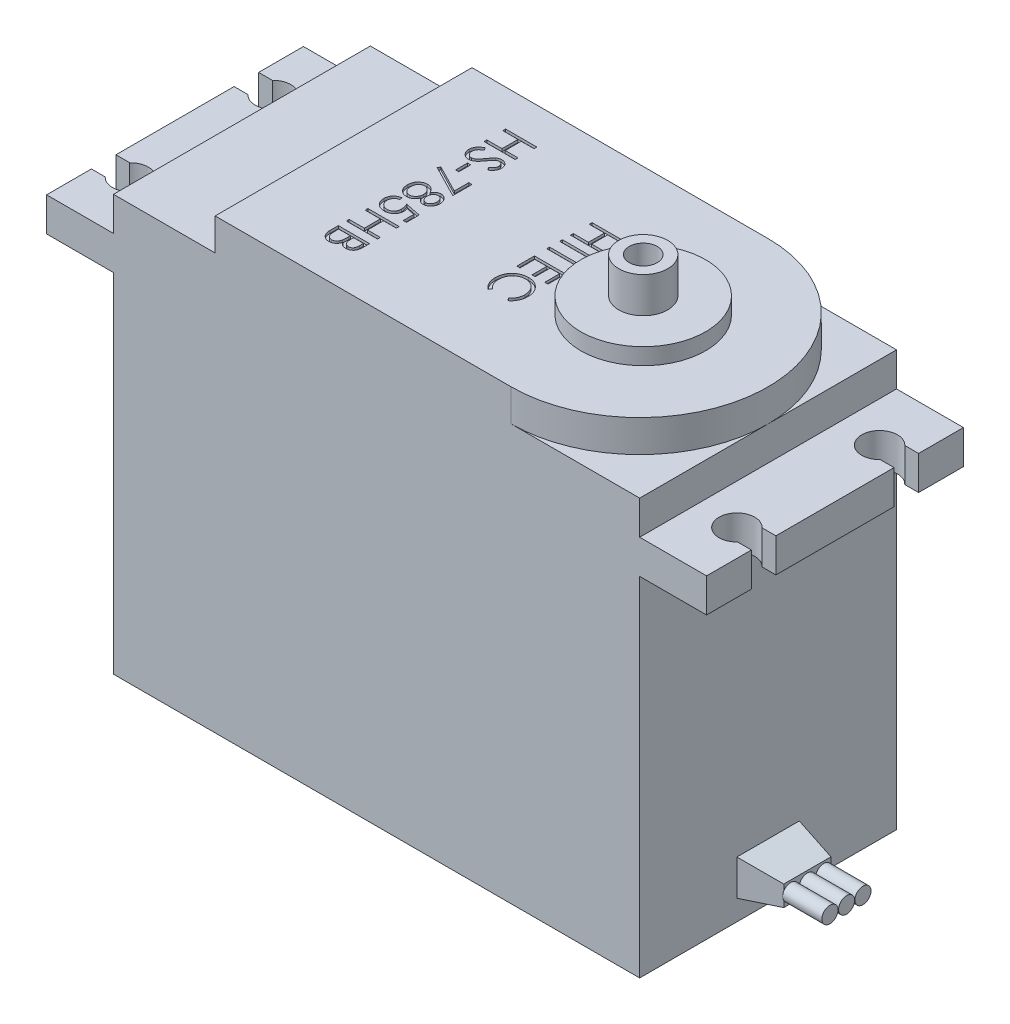
from build123d import *

# Parameters (mm, degrees)
SKETCH1_W                        = 59
SKETCH1_H                        = 46.6
BOSS_EXTRUDE1_DEPTH              = 28.8
BOSS_EXTRUDE2_DEPTH              = 3.6
SKETCH3_R                        = 7
BOSS_EXTRUDE3_DEPTH              = 1.85
BOSS_EXTRUDE4_DEPTH              = 3.8
SKETCH5_W                        = 7
SKETCH5_H                        = 4
BOSS_EXTRUDE5_DEPTH              = 4.4
BOSS_EXTRUDE5_TAPER              = 11
SKETCH6_R                        = 0.902956787
BOSS_EXTRUDE6_DEPTH              = 4.4
SKETCH7_R                        = 2.75
BOSS_EXTRUDE7_DEPTH              = 4
TAP_DRILL_FOR_M3_HELICOIL1_D     = 3.15
TAP_DRILL_FOR_M3_HELICOIL1_DEPTH = 3
TAP_DRILL_FOR_M3_HELICOIL1_TIP   = 0.946355475
SKETCH10_W                       = 3.5
SKETCH10_H                       = 0.314102564
SKETCH10_W_2                     = 0.358974359
SKETCH10_H_2                     = 1.346153846
CUT_EXTRUDE1_DEPTH               = 0.3


with BuildPart() as part:
    # Sketch1 → Boss-Extrude1 (new body)
    with BuildSketch(Plane.XY):
        with Locations((29.5, 23.3)):
            Rectangle(SKETCH1_W, SKETCH1_H)
    extrude(amount=BOSS_EXTRUDE1_DEPTH)

    # Sketch2 → Boss-Extrude2 (add)
    with BuildSketch(Plane(origin=(0, 46.6, 0), x_dir=(1, 0, 0), z_dir=(0, 1, 0))):
        with BuildLine():
            Line((11.4, 0), (44.6, 0))
            ThreePointArc((44.6, 0), (59, -14.4), (44.6, -28.8))
            Line((44.6, -28.8), (11.4, -28.8))
            Line((11.4, -28.8), (11.4, 0))
        make_face()
    extrude(amount=BOSS_EXTRUDE2_DEPTH)

    # Sketch3 → Boss-Extrude3 (add)
    with BuildSketch(Plane(origin=(0, 50.2, 0), x_dir=(1, 0, 0), z_dir=(0, 1, 0))):
        with Locations(Location((45, -14.4, 0), (0, 0, 270))):
            Circle(SKETCH3_R)
    extrude(amount=BOSS_EXTRUDE3_DEPTH)

    # Sketch4 → Boss-Extrude4 (add)
    with BuildSketch(Plane(origin=(0, 39, 0), x_dir=(-1, 0, 0), z_dir=(0, -1, 0))):
        with BuildLine():
            Line((-66.5, 0), (7.5, 0))
            Line((7.5, 0), (7.5, -5.025))
            Line((7.5, -5.025), (5.952368755, -5.025))
            ThreePointArc((5.952368755, -5.025), (2.5, -6.4), (5.952368755, -7.775))
            Line((5.952368755, -7.775), (7.5, -7.775))
            Line((7.5, -7.775), (7.5, -21.025))
            Line((7.5, -21.025), (5.952368755, -21.025))
            ThreePointArc((5.952368755, -21.025), (2.5, -22.4), (5.952368755, -23.775))
            Line((5.952368755, -23.775), (7.5, -23.775))
            Line((7.5, -23.775), (7.5, -28.8))
            Line((7.5, -28.8), (-66.5, -28.8))
            Line((-66.5, -28.8), (-66.5, -23.775))
            Line((-66.5, -23.775), (-64.952368755, -23.775))
            ThreePointArc((-64.952368755, -23.775), (-61.5, -22.4), (-64.952368755, -21.025))
            Line((-64.952368755, -21.025), (-66.5, -21.025))
            Line((-66.5, -21.025), (-66.5, -7.775))
            Line((-66.5, -7.775), (-64.952368755, -7.775))
            ThreePointArc((-64.952368755, -7.775), (-61.5, -6.4), (-64.952368755, -5.025))
            Line((-64.952368755, -5.025), (-66.5, -5.025))
            Line((-66.5, -5.025), (-66.5, 0))
        make_face()
    extrude(amount=-BOSS_EXTRUDE4_DEPTH)

    # Sketch5 → Boss-Extrude5 (add)
    with BuildSketch(Plane(origin=(59, 0, 0), x_dir=(0, 0, -1), z_dir=(1, 0, 0))):
        with Locations((-14.4, 4.3)):
            Rectangle(SKETCH5_W, SKETCH5_H)
    extrude(amount=BOSS_EXTRUDE5_DEPTH, taper=BOSS_EXTRUDE5_TAPER)

    # Sketch6 → Boss-Extrude6 (add)
    with BuildSketch(Plane(origin=(63.4, 0, 0), x_dir=(0, 0, -1), z_dir=(1, 0, 0))):
        with Locations((-14.4, 4.3)):
            Circle(SKETCH6_R)
        with Locations(Location((-12.562723312, 4.3, 0), (0, 0, 333.409541009))):
            Circle(SKETCH6_R)
        with Locations(Location((-16.265911653, 4.3, 0), (0, 0, 210.399697168))):
            Circle(SKETCH6_R)
    extrude(amount=BOSS_EXTRUDE6_DEPTH)

    # Sketch7 → Boss-Extrude7 (add)
    with BuildSketch(Plane(origin=(0, 52.05, 0), x_dir=(1, 0, 0), z_dir=(0, 1, 0))):
        with Locations(Location((45, -14.4, 0), (0, 0, 270))):
            Circle(SKETCH7_R)
    extrude(amount=BOSS_EXTRUDE7_DEPTH)

    # Tap Drill for M3 Helicoil1
    with Locations(Plane(origin=(0, 56.05, 0), x_dir=(1, 0, 0), z_dir=(0, 1, 0))):
        with Locations((45, -14.4)):
            Hole(TAP_DRILL_FOR_M3_HELICOIL1_D / 2, depth=TAP_DRILL_FOR_M3_HELICOIL1_DEPTH)
            with Locations((0, 0, -(TAP_DRILL_FOR_M3_HELICOIL1_DEPTH + TAP_DRILL_FOR_M3_HELICOIL1_TIP / 2))):  # 118° drill point
                Cone(0, TAP_DRILL_FOR_M3_HELICOIL1_D / 2, TAP_DRILL_FOR_M3_HELICOIL1_TIP, mode=Mode.SUBTRACT)

    # Sketch10 → Cut-Extrude1 (cut)
    # profile 1 of 13: a face of its own
    with BuildSketch(Plane(origin=(0, 50.2, 0), x_dir=(1, 0, 0), z_dir=(0, 1, 0))):
        Polygon((36.683305058, -8.319871795), (36.683305058, -8.633974359), (35.247407622, -8.633974359), (35.247407622, -10.428846154), (36.683305058, -10.428846154), (36.683305058, -10.742948718), (33.183305058, -10.742948718), (33.183305058, -10.428846154), (34.888433263, -10.428846154), (34.888433263, -8.633974359), (33.183305058, -8.633974359), (33.183305058, -8.319871795), align=None)
    # profile 2 of 13: a face of its own
    with BuildSketch(Plane(origin=(0, 50.2, 0), x_dir=(1, 0, 0), z_dir=(0, 1, 0))):
        with Locations((34.933305058, -11.797435897)):
            Rectangle(SKETCH10_W, SKETCH10_H)
    # profile 3 of 13: a face of its own
    with BuildSketch(Plane(origin=(0, 50.2, 0), x_dir=(1, 0, 0), z_dir=(0, 1, 0))):
        Polygon((36.324330699, -12.313461538), (36.683305058, -12.313461538), (36.683305058, -14.153205128), (36.324330699, -14.153205128), (36.324330699, -13.390384615), (33.183305058, -13.390384615), (33.183305058, -13.076282051), (36.324330699, -13.076282051), align=None)
    # profile 4 of 13: a face of its own
    with BuildSketch(Plane(origin=(0, 50.2, 0), x_dir=(1, 0, 0), z_dir=(0, 1, 0))):
        Polygon((36.683305058, -14.781410256), (36.683305058, -16.755769231), (36.324330699, -16.755769231), (36.324330699, -15.095512821), (35.247407622, -15.095512821), (35.247407622, -16.755769231), (34.888433263, -16.755769231), (34.888433263, -15.095512821), (33.542279417, -15.095512821), (33.542279417, -16.755769231), (33.183305058, -16.755769231), (33.183305058, -14.781410256), align=None)
    # profile 5 of 13: a face of its own
    with BuildSketch(Plane(origin=(0, 50.2, 0), x_dir=(1, 0, 0), z_dir=(0, 1, 0))):
        with BuildLine():
            Line((36.041077494, -20.61474359), (35.830740956, -20.339903846))
            add(Edge.make_bspline(
                [(35.830740956, -20.339903846), (35.854106926, -20.320297958), (35.900523841, -20.281350511), (35.965703386, -20.218691308), (36.026768647, -20.153389666), (36.084010527, -20.085470544), (36.135427293, -20.013711425), (36.183698395, -19.939850626), (36.226966133, -19.862652581), (36.27942912, -19.755900846), (36.334175275, -19.616252998), (36.380078506, -19.440458159), (36.409299682, -19.25694706), (36.412464523, -19.131749461), (36.414074289, -19.06806891)],
                knots=[0, 0, 0, 0, 0.757959112, 1.505699292, 2.245454638, 2.979532153, 3.711538275, 4.438200793, 5.171680507, 5.909471876, 7.393775596, 8.890124382, 10.418191784, 12, 12, 12, 12], degree=3))
            add(Edge.make_bspline(
                [(36.414074289, -19.06806891), (36.413668504, -19.032986037), (36.412860699, -18.963145894), (36.402278474, -18.859491127), (36.387233738, -18.757575594), (36.365453359, -18.657778283), (36.33709728, -18.560297345), (36.30384317, -18.464390545), (36.262461804, -18.371187409), (36.21676161, -18.27956626), (36.165128789, -18.191791102), (36.108828525, -18.108723125), (36.048413397, -18.030741827), (35.984039353, -17.95763112), (35.914906353, -17.890192822), (35.841827667, -17.827346132), (35.7639237, -17.770223697), (35.682655477, -17.717421831), (35.597903548, -17.670437615), (35.510201074, -17.629864469), (35.419883374, -17.59508991), (35.326765425, -17.567318559), (35.23121367, -17.54541356), (35.133025326, -17.530280591), (35.032390981, -17.519793562), (34.964181759, -17.518993189), (34.929799449, -17.518589744)],
                knots=[0, 0, 0, 0, 1.055000685, 2.100209969, 3.131349012, 4.153242145, 5.170189196, 6.184191144, 7.204341339, 8.235672124, 9.263040994, 10.265373269, 11.252624173, 12.22887325, 13.193405896, 14.155809299, 15.126090485, 16.097288279, 17.069732292, 18.038585918, 19.002221264, 19.978698174, 20.959418239, 21.948869816, 22.966084182, 24, 24, 24, 24], degree=3))
            add(Edge.make_bspline(
                [(34.929799449, -17.518589744), (34.878068129, -17.519851563), (34.776500545, -17.522328977), (34.627729934, -17.544377311), (34.48520926, -17.577882402), (34.349829418, -17.628097979), (34.21992106, -17.69001703), (34.097682206, -17.768257641), (33.981265642, -17.858874179), (33.873422694, -17.963148598), (33.774908969, -18.077554414), (33.688158387, -18.200302326), (33.615843505, -18.331086613), (33.555667558, -18.468463244), (33.509410831, -18.613489358), (33.476846707, -18.76590416), (33.455604527, -18.925376155), (33.453570839, -19.034345555), (33.452535828, -19.089803686)],
                knots=[0, 0, 0, 0, 1.029171465, 2.020641659, 2.987623507, 3.938342917, 4.889210282, 5.84687017, 6.821220943, 7.821438502, 8.827599549, 9.822697543, 10.807740252, 11.797342354, 12.80366471, 13.83203677, 14.896651826, 16, 16, 16, 16], degree=3))
            add(Edge.make_bspline(
                [(33.452535828, -19.089803686), (33.454224607, -19.150906375), (33.45754853, -19.271171084), (33.485707779, -19.44753911), (33.531365697, -19.616374876), (33.595263619, -19.777687462), (33.678328907, -19.931022109), (33.779026784, -20.076618769), (33.898315117, -20.214600339), (33.989398245, -20.297571622), (34.035869161, -20.339903846)],
                knots=[0, 0, 0, 0, 1.028121516, 2.023589091, 2.998037872, 3.967518031, 4.937445131, 5.927275754, 6.942489185, 8, 8, 8, 8], degree=3))
            Line((34.035869161, -20.339903846), (33.827635988, -20.61474359))
            add(Edge.make_bspline(
                [(33.827635988, -20.61474359), (33.799097487, -20.592625509), (33.742157183, -20.548495293), (33.661886197, -20.47703684), (33.586379459, -20.401761169), (33.516261894, -20.322099407), (33.450069724, -20.239004308), (33.390021991, -20.151012194), (33.334289542, -20.05964286), (33.283933108, -19.96436434), (33.238783038, -19.865489446), (33.200666101, -19.763121075), (33.167359007, -19.658126498), (33.140138788, -19.550452839), (33.11885907, -19.43974039), (33.104641766, -19.326369008), (33.094899211, -19.210099378), (33.094011383, -19.131657923), (33.093561469, -19.091907051)],
                knots=[0, 0, 0, 0, 0.986756325, 1.968786143, 2.935506311, 3.899499537, 4.868307269, 5.8376204, 6.809456583, 7.792545619, 8.781780509, 9.778496008, 10.776623214, 11.79151764, 12.812666265, 13.856269958, 14.913646641, 16, 16, 16, 16], degree=3))
            add(Edge.make_bspline(
                [(33.093561469, -19.091907051), (33.093823461, -19.054263384), (33.094341519, -18.979827694), (33.102733686, -18.869928943), (33.114183423, -18.762939362), (33.131423554, -18.659164736), (33.151767894, -18.558038761), (33.179039151, -18.460478176), (33.209588318, -18.365522966), (33.245493304, -18.273554625), (33.286009487, -18.184494925), (33.331801046, -18.098631114), (33.38248291, -18.016002682), (33.436937921, -17.935797261), (33.496915223, -17.859199677), (33.561581857, -17.785546152), (33.630719868, -17.714423676), (33.680574721, -17.670420991), (33.705640795, -17.648297276)],
                knots=[0, 0, 0, 0, 1.114604814, 2.203992996, 3.262667896, 4.300477797, 5.318619304, 6.316056647, 7.298880507, 8.271930387, 9.238335007, 10.195173496, 11.151986948, 12.108099108, 13.064862484, 14.031167946, 15.010108607, 16, 16, 16, 16], degree=3))
            add(Edge.make_bspline(
                [(33.705640795, -17.648297276), (33.749181984, -17.612861632), (33.835738695, -17.542418155), (33.976024676, -17.452292472), (34.122492885, -17.375144917), (34.275912814, -17.312768996), (34.435940201, -17.264006263), (34.602655715, -17.230225068), (34.775903658, -17.208273463), (34.893740446, -17.205763174), (34.95363759, -17.204487179)],
                knots=[0, 0, 0, 0, 0.994628077, 1.977248131, 2.950237994, 3.925870899, 4.908910175, 5.911660606, 6.938484602, 8, 8, 8, 8], degree=3))
            add(Edge.make_bspline(
                [(34.95363759, -17.204487179), (35.01659041, -17.206049329), (35.140446152, -17.209122761), (35.322257699, -17.235019276), (35.496195366, -17.277183806), (35.662928426, -17.335244644), (35.821502893, -17.411842414), (35.972588496, -17.504570209), (36.116061868, -17.614333755), (36.25008869, -17.739754528), (36.372624778, -17.877329111), (36.480431835, -18.02464603), (36.570149126, -18.181428476), (36.645145349, -18.345946194), (36.702789796, -18.519431912), (36.743142987, -18.701515271), (36.768260102, -18.891854188), (36.77143531, -19.021716614), (36.773048648, -19.087700321)],
                knots=[0, 0, 0, 0, 1.032901378, 2.032168977, 3.007206631, 3.966850309, 4.924221947, 5.891988639, 6.871730993, 7.884084801, 8.900290346, 9.89161143, 10.874607481, 11.860025555, 12.854717796, 13.869097222, 14.917278314, 16, 16, 16, 16], degree=3))
            add(Edge.make_bspline(
                [(36.773048648, -19.087700321), (36.77256687, -19.127914871), (36.771613239, -19.207515525), (36.762301875, -19.325267035), (36.746807469, -19.439913561), (36.725579086, -19.551732359), (36.699560204, -19.661128908), (36.665499477, -19.76698088), (36.625946623, -19.86986468), (36.581554218, -19.969857361), (36.530803527, -20.065871033), (36.475682957, -20.157888224), (36.414920141, -20.244798913), (36.350523899, -20.328237898), (36.280085389, -20.406326703), (36.205898495, -20.481295523), (36.125761834, -20.550554655), (36.06935728, -20.593308111), (36.041077494, -20.61474359)],
                knots=[0, 0, 0, 0, 1.096705196, 2.170817488, 3.219277236, 4.250701065, 5.274195539, 6.284202015, 7.28098643, 8.279664616, 9.266225751, 10.241373748, 11.203306326, 12.157093976, 13.114198862, 14.069774147, 15.032234603, 16, 16, 16, 16], degree=3))
        make_face()
    # profile 6 of 13: a face of its own
    with BuildSketch(Plane(origin=(0, 50.2, 0), x_dir=(1, 0, 0), z_dir=(0, 1, 0))):
        Polygon((22.747407622, -4.079487179), (22.747407622, -4.393589744), (21.311510186, -4.393589744), (21.311510186, -6.188461538), (22.747407622, -6.188461538), (22.747407622, -6.502564103), (19.247407622, -6.502564103), (19.247407622, -6.188461538), (20.952535828, -6.188461538), (20.952535828, -4.393589744), (19.247407622, -4.393589744), (19.247407622, -4.079487179), align=None)
    # profile 7 of 13: a face of its own
    with BuildSketch(Plane(origin=(0, 50.2, 0), x_dir=(1, 0, 0), z_dir=(0, 1, 0))):
        with BuildLine():
            Line((19.922587911, -7.041025641), (20.099971725, -7.336899038))
            add(Edge.make_bspline(
                [(20.099971725, -7.336899038), (20.05390734, -7.364417276), (19.965649756, -7.417141156), (19.846391716, -7.505092515), (19.745029559, -7.596225427), (19.662152951, -7.69121476), (19.596904065, -7.789480708), (19.550701833, -7.891664762), (19.521885858, -7.997422573), (19.518385771, -8.069396394), (19.516638392, -8.105328526)],
                knots=[0, 0, 0, 0, 1.272034388, 2.437168799, 3.508375237, 4.49857839, 5.41946034, 6.295179144, 7.148887113, 8, 8, 8, 8], degree=3))
            add(Edge.make_bspline(
                [(19.516638392, -8.105328526), (19.517493063, -8.136015389), (19.519187451, -8.196852169), (19.535468269, -8.286414365), (19.560480339, -8.373396343), (19.596301492, -8.456004325), (19.639639177, -8.533102307), (19.691988167, -8.600700683), (19.750584394, -8.659176318), (19.81600334, -8.706878063), (19.886116253, -8.743909237), (19.958727613, -8.770706019), (20.033518027, -8.78776056), (20.084223671, -8.78993126), (20.10978743, -8.791025641)],
                knots=[0, 0, 0, 0, 1.095270387, 2.171376115, 3.241375676, 4.322296363, 5.380636668, 6.392615365, 7.366724986, 8.328592944, 9.273498763, 10.190095884, 11.087518669, 12, 12, 12, 12], degree=3))
            add(Edge.make_bspline(
                [(20.10978743, -8.791025641), (20.13892828, -8.78955133), (20.198167369, -8.786554272), (20.285567022, -8.761222792), (20.372059592, -8.721373545), (20.425560857, -8.684610901), (20.45333711, -8.66552484)],
                knots=[0, 0, 0, 0, 0.938893495, 1.908633276, 2.914225137, 4, 4, 4, 4], degree=3))
            add(Edge.make_bspline(
                [(20.45333711, -8.66552484), (20.473424914, -8.649898589), (20.515720536, -8.616996933), (20.577626006, -8.559650246), (20.643041848, -8.494108524), (20.711702424, -8.420044108), (20.782353821, -8.33598475), (20.856468773, -8.243656508), (20.933824538, -8.142581436), (20.98497915, -8.071348293), (21.011430058, -8.034515224)],
                knots=[0, 0, 0, 0, 0.72226686, 1.520759855, 2.393439377, 3.351307446, 4.386958158, 5.510256019, 6.712608938, 8, 8, 8, 8], degree=3))
            add(Edge.make_bspline(
                [(21.011430058, -8.034515224), (21.037664649, -7.99769614), (21.08782319, -7.927300855), (21.162169862, -7.828778771), (21.230577014, -7.740796461), (21.292091762, -7.662905611), (21.349397065, -7.597121357), (21.39942168, -7.54103881), (21.444836864, -7.496727067), (21.474274834, -7.472068628), (21.487491757, -7.460997596)],
                knots=[0, 0, 0, 0, 1.452255772, 2.776602448, 3.96446981, 5.032613149, 5.964194703, 6.766668629, 7.446264616, 8, 8, 8, 8], degree=3))
            add(Edge.make_bspline(
                [(21.487491757, -7.460997596), (21.508092794, -7.445525051), (21.548607498, -7.415096214), (21.611932355, -7.374930209), (21.676755621, -7.340791046), (21.743251485, -7.314028714), (21.810486414, -7.291492495), (21.87933766, -7.276334564), (21.949496278, -7.266843167), (21.996709779, -7.265871181), (22.020344321, -7.265384615)],
                knots=[0, 0, 0, 0, 1.068054152, 2.10047183, 3.106115577, 4.101338837, 5.06977816, 6.043150881, 7.020423561, 8, 8, 8, 8], degree=3))
            add(Edge.make_bspline(
                [(22.020344321, -7.265384615), (22.057377196, -7.266684131), (22.130651394, -7.269255386), (22.237637242, -7.291178507), (22.340091869, -7.325377128), (22.435758513, -7.374838346), (22.524413456, -7.435990725), (22.604702196, -7.508263232), (22.672773126, -7.594070926), (22.731558291, -7.68874351), (22.777971638, -7.791701207), (22.813169233, -7.89939519), (22.832846845, -8.012297701), (22.835702325, -8.088897337), (22.837151212, -8.127764423)],
                knots=[0, 0, 0, 0, 1.005541892, 1.989591032, 2.955705311, 3.932863626, 4.905387107, 5.876519979, 6.856563935, 7.871847665, 8.897921447, 9.918317993, 10.943742853, 12, 12, 12, 12], degree=3))
            add(Edge.make_bspline(
                [(22.837151212, -8.127764423), (22.835755309, -8.169014671), (22.832987065, -8.250818846), (22.808056049, -8.371374893), (22.767784565, -8.487668665), (22.721401583, -8.581279452), (22.675283691, -8.654416578), (22.633260872, -8.710188344), (22.584886653, -8.766706082), (22.530027144, -8.824424052), (22.46818047, -8.882364737), (22.399769759, -8.941388182), (22.325213209, -9.001632453), (22.271988708, -9.040388312), (22.244703295, -9.06025641)],
                knots=[0, 0, 0, 0, 1.286821612, 2.551921131, 3.825787379, 5.12137259, 5.803616487, 6.523126609, 7.299589446, 8.125436757, 9.008162487, 9.944516264, 10.946261234, 12, 12, 12, 12], degree=3))
            Line((22.244703295, -9.06025641), (22.029458904, -8.776302083))
            add(Edge.make_bspline(
                [(22.029458904, -8.776302083), (22.051547595, -8.759156151), (22.09408525, -8.726137094), (22.153656557, -8.676007605), (22.208073065, -8.628758966), (22.255338101, -8.582208537), (22.298040533, -8.538815001), (22.334599308, -8.496697646), (22.365378092, -8.45646431), (22.398208343, -8.405743161), (22.430958948, -8.341857599), (22.458082041, -8.261741847), (22.474968056, -8.178246762), (22.477095496, -8.121534572), (22.478176853, -8.092708333)],
                knots=[0, 0, 0, 0, 1.181667846, 2.275615987, 3.290305621, 4.226321945, 5.078535498, 5.862783384, 6.581873284, 7.217493746, 8.414623899, 9.604724551, 10.782505457, 12, 12, 12, 12], degree=3))
            add(Edge.make_bspline(
                [(22.478176853, -8.092708333), (22.476965153, -8.056551811), (22.474628504, -7.986827364), (22.449108519, -7.887837127), (22.408926658, -7.798743202), (22.35261168, -7.722190637), (22.285890688, -7.65845366), (22.209111833, -7.612348201), (22.12432943, -7.584598037), (22.065187774, -7.581211757), (22.035067879, -7.579487179)],
                knots=[0, 0, 0, 0, 1.14458467, 2.207223713, 3.21896685, 4.227309161, 5.202851033, 6.127160689, 7.046193047, 8, 8, 8, 8], degree=3))
            add(Edge.make_bspline(
                [(22.035067879, -7.579487179), (22.016321181, -7.579898608), (21.978797131, -7.580722137), (21.923212493, -7.59143301), (21.868121261, -7.606620707), (21.813278466, -7.628848836), (21.75739389, -7.658789128), (21.700618414, -7.699498924), (21.641518595, -7.750428556), (21.603118444, -7.789518132), (21.582844321, -7.81015625)],
                knots=[0, 0, 0, 0, 0.858526328, 1.718456515, 2.587092892, 3.476767204, 4.426280253, 5.487868114, 6.673670035, 8, 8, 8, 8], degree=3))
            add(Edge.make_bspline(
                [(21.582844321, -7.81015625), (21.576007295, -7.817817622), (21.559764087, -7.83601929), (21.533171806, -7.869295215), (21.500369034, -7.913238014), (21.459781718, -7.966700215), (21.412700255, -8.030667576), (21.359726643, -8.105147133), (21.299141184, -8.189308665), (21.256783644, -8.249030581), (21.234386789, -8.280608974)],
                knots=[0, 0, 0, 0, 0.420754252, 0.999615792, 1.744751191, 2.668019286, 3.750313428, 4.999500688, 6.413464383, 8, 8, 8, 8], degree=3))
            add(Edge.make_bspline(
                [(21.234386789, -8.280608974), (21.20674543, -8.318594888), (21.153221768, -8.392149344), (21.072806088, -8.496806924), (20.994158319, -8.591700732), (20.917780712, -8.677163936), (20.844252619, -8.754040844), (20.772689439, -8.821478565), (20.703603866, -8.880164245), (20.61503129, -8.943343464), (20.506250206, -9.007901283), (20.372971968, -9.06334279), (20.239175647, -9.098301138), (20.149248811, -9.102872653), (20.104879578, -9.105128205)],
                knots=[0, 0, 0, 0, 1.163667725, 2.253281268, 3.268753668, 4.215851969, 5.092017293, 5.902905408, 6.650798638, 7.335211899, 8.59617414, 9.77448103, 10.901945474, 12, 12, 12, 12], degree=3))
            add(Edge.make_bspline(
                [(20.104879578, -9.105128205), (20.07350146, -9.104470702), (20.011354566, -9.103168464), (19.920095892, -9.088212859), (19.831478401, -9.066273451), (19.746517186, -9.033310155), (19.664075396, -8.992762186), (19.584912437, -8.942679626), (19.510116551, -8.882305131), (19.438131244, -8.815201326), (19.373107817, -8.740626695), (19.314951644, -8.661994883), (19.266275292, -8.578795404), (19.227090704, -8.491430953), (19.195958345, -8.400384812), (19.173581057, -8.305561166), (19.159815692, -8.206695958), (19.158389259, -8.139494884), (19.157664033, -8.105328526)],
                knots=[0, 0, 0, 0, 0.983610584, 1.948120116, 2.894308362, 3.843560551, 4.801159957, 5.773581695, 6.77566113, 7.813174769, 8.857584665, 9.875476876, 10.877851407, 11.875574773, 12.875048225, 13.892438445, 14.928473903, 16, 16, 16, 16], degree=3))
            add(Edge.make_bspline(
                [(19.157664033, -8.105328526), (19.158181072, -8.078894349), (19.159208638, -8.026358908), (19.168077769, -7.948861211), (19.181084459, -7.872786606), (19.200914949, -7.799090303), (19.225541268, -7.726854648), (19.255692632, -7.656723527), (19.291586299, -7.588526555), (19.33328172, -7.522184095), (19.381334224, -7.457071012), (19.436865892, -7.39352112), (19.499493156, -7.330807404), (19.569858274, -7.270079502), (19.647209466, -7.210218042), (19.732194859, -7.152336254), (19.824373289, -7.095255496), (19.889238223, -7.059439893), (19.922587911, -7.041025641)],
                knots=[0, 0, 0, 0, 0.915384692, 1.819241058, 2.699029451, 3.586605375, 4.459625921, 5.340865773, 6.228072412, 7.126546901, 8.052715223, 9.028303326, 10.047266019, 11.120332924, 12.245748783, 13.433636234, 14.680528497, 16, 16, 16, 16], degree=3))
        make_face()
    # profile 8 of 13: a face of its own
    with BuildSketch(Plane(origin=(0, 50.2, 0), x_dir=(1, 0, 0), z_dir=(0, 1, 0))):
        with Locations((20.593561468, -10.182051282)):
            Rectangle(SKETCH10_W_2, SKETCH10_H_2)
    # profile 9 of 13: a face of its own
    with BuildSketch(Plane(origin=(0, 50.2, 0), x_dir=(1, 0, 0), z_dir=(0, 1, 0))):
        Polygon((22.747407622, -11.348717949), (22.747407622, -13.502564103), (19.157664033, -11.662820513), (19.307002975, -11.391486378), (22.388433263, -12.971113782), (22.388433263, -11.348717949), align=None)
    # profile 10 of 13: a face of its own
    with BuildSketch(Plane(origin=(0, 50.2, 0), x_dir=(1, 0, 0), z_dir=(0, 1, 0))):
        with BuildLine():
            add(Edge.make_bspline(
                [(21.197227334, -15.518289263), (21.182271116, -15.546695609), (21.153010253, -15.602270771), (21.10604672, -15.681788287), (21.056987151, -15.754998735), (21.007371571, -15.82294546), (20.955238821, -15.884242578), (20.901183963, -15.939295695), (20.846654955, -15.989831968), (20.789518167, -16.033194521), (20.730952058, -16.071432312), (20.670453196, -16.1044337), (20.608212405, -16.132653753), (20.543534899, -16.155015934), (20.477374822, -16.173437933), (20.40887679, -16.186113482), (20.338492463, -16.192930415), (20.290924159, -16.194219226), (20.266838712, -16.194871795)],
                knots=[0, 0, 0, 0, 1.264385854, 2.473688339, 3.635349404, 4.734491366, 5.785876313, 6.801388178, 7.772322209, 8.711311751, 9.622826105, 10.524996139, 11.423212571, 12.31118177, 13.217849097, 14.126010572, 15.051135535, 16, 16, 16, 16], degree=3))
            add(Edge.make_bspline(
                [(20.266838712, -16.194871795), (20.233138666, -16.194107236), (20.166433629, -16.192593888), (20.068021159, -16.179194139), (19.972215199, -16.159637484), (19.879941981, -16.129183544), (19.790045209, -16.092808209), (19.704168574, -16.04601347), (19.619910751, -15.993499578), (19.568096616, -15.951234031), (19.541878776, -15.929847756)],
                knots=[0, 0, 0, 0, 1.02534174, 2.029536028, 3.018826961, 3.997522084, 4.983122576, 5.966563916, 6.971085759, 8, 8, 8, 8], degree=3))
            add(Edge.make_bspline(
                [(19.541878776, -15.929847756), (19.511285002, -15.902011282), (19.450475509, -15.846682317), (19.371524699, -15.751899389), (19.305175305, -15.647877505), (19.251103411, -15.535019172), (19.209017552, -15.413626071), (19.178775034, -15.283724066), (19.161452605, -15.145059914), (19.158948615, -15.049754442), (19.157664033, -15.000861378)],
                knots=[0, 0, 0, 0, 0.954267603, 1.896743057, 2.838368354, 3.796610408, 4.779680527, 5.799409237, 6.871065594, 8, 8, 8, 8], degree=3))
            add(Edge.make_bspline(
                [(19.157664033, -15.000861378), (19.158819603, -14.953849072), (19.161068227, -14.8623679), (19.176220079, -14.729195118), (19.203044647, -14.604906451), (19.239000366, -14.48891265), (19.286948132, -14.382335231), (19.345718237, -14.284980801), (19.413983223, -14.195421046), (19.493388291, -14.116470754), (19.578448536, -14.046383315), (19.66619954, -13.984815006), (19.756653052, -13.933640993), (19.848459379, -13.89031388), (19.942905544, -13.857145862), (20.039505554, -13.834173651), (20.138090698, -13.819584337), (20.204622351, -13.817643202), (20.238092719, -13.816666667)],
                knots=[0, 0, 0, 0, 1.256882982, 2.445766618, 3.576898315, 4.651879663, 5.686612882, 6.692806257, 7.686348993, 8.689277895, 9.678883454, 10.630458183, 11.551151498, 12.454054546, 13.341321255, 14.221808008, 15.105437234, 16, 16, 16, 16], degree=3))
            add(Edge.make_bspline(
                [(20.238092719, -13.816666667), (20.262651929, -13.81724452), (20.311189598, -13.818386562), (20.382898657, -13.826291813), (20.452695788, -13.838998781), (20.520832847, -13.856263762), (20.586835781, -13.879634311), (20.65093522, -13.907952937), (20.713623656, -13.940653137), (20.773823403, -13.979847905), (20.83354072, -14.022999438), (20.889858769, -14.074186964), (20.945914916, -14.13032768), (20.999283615, -14.193713744), (21.052529979, -14.262405067), (21.102265491, -14.338483625), (21.152129154, -14.419811966), (21.181936678, -14.477618205), (21.197227334, -14.507271635)],
                knots=[0, 0, 0, 0, 0.941717298, 1.86116577, 2.762973304, 3.660719123, 4.553575492, 5.444450535, 6.34648071, 7.261375261, 8.197060099, 9.168336537, 10.175980388, 11.237504102, 12.343496232, 13.506792996, 14.721035322, 16, 16, 16, 16], degree=3))
            add(Edge.make_bspline(
                [(21.197227334, -14.507271635), (21.219358654, -14.466676055), (21.262211085, -14.388071651), (21.3410046, -14.284059164), (21.426030686, -14.194573325), (21.520099482, -14.123082091), (21.619067847, -14.06635321), (21.722618633, -14.026293233), (21.829511921, -14.000133573), (21.902405433, -13.997484347), (21.939014193, -13.996153846)],
                knots=[0, 0, 0, 0, 1.16709546, 2.25982348, 3.287408737, 4.277418348, 5.234967981, 6.16072867, 7.076276605, 8, 8, 8, 8], degree=3))
            add(Edge.make_bspline(
                [(21.939014193, -13.996153846), (21.976311712, -13.997789302), (22.051286229, -14.001076853), (22.162892961, -14.027659686), (22.272507084, -14.070981709), (22.379612466, -14.129894962), (22.480525374, -14.203312055), (22.571338306, -14.29137512), (22.650200088, -14.392577349), (22.716825106, -14.505121891), (22.771320252, -14.626000344), (22.808520752, -14.753758046), (22.832988209, -14.886111927), (22.835750587, -14.976211367), (22.837151212, -15.021895032)],
                knots=[0, 0, 0, 0, 0.888753872, 1.786550278, 2.720173491, 3.693036334, 4.694165094, 5.687489879, 6.699912706, 7.744713188, 8.800178723, 9.852977058, 10.911381959, 12, 12, 12, 12], degree=3))
            add(Edge.make_bspline(
                [(22.837151212, -15.021895032), (22.835711064, -15.066400452), (22.832871256, -15.15416007), (22.808954239, -15.283351314), (22.769452508, -15.407065069), (22.715666001, -15.524626262), (22.64859261, -15.633466216), (22.568935253, -15.730643447), (22.478441412, -15.815885997), (22.377801805, -15.886709686), (22.27069902, -15.943865025), (22.159310157, -15.984568357), (22.045127855, -16.010458995), (21.967894266, -16.013740505), (21.929198488, -16.015384615)],
                knots=[0, 0, 0, 0, 1.072712831, 2.115267497, 3.156282165, 4.197922255, 5.225560591, 6.230883479, 7.219814004, 8.214446311, 9.19021444, 10.138875805, 11.067534608, 12, 12, 12, 12], degree=3))
            add(Edge.make_bspline(
                [(21.929198488, -16.015384615), (21.891221599, -16.013950261), (21.816637147, -16.01113327), (21.707913839, -15.98743039), (21.606079814, -15.947528048), (21.510052326, -15.892992271), (21.42115997, -15.822023961), (21.339698291, -15.734744693), (21.262428992, -15.633863105), (21.21944704, -15.557675022), (21.197227334, -15.518289263)],
                knots=[0, 0, 0, 0, 0.975287281, 1.915408787, 2.843441052, 3.776938647, 4.743139116, 5.754296123, 6.83907365, 8, 8, 8, 8], degree=3))
        make_face()
        with BuildLine():
            add(Edge.make_bspline(
                [(22.478176853, -15.004366987), (22.477525413, -14.979816181), (22.47625091, -14.93178407), (22.469592273, -14.861355399), (22.456639056, -14.794383032), (22.439400345, -14.730167231), (22.416112357, -14.669588419), (22.388717347, -14.611823864), (22.355411282, -14.557856674), (22.318050084, -14.507035372), (22.276957178, -14.461284597), (22.234143459, -14.420680045), (22.188768067, -14.386951931), (22.141959707, -14.358310822), (22.092329131, -14.337529304), (22.041397955, -14.321965), (21.988522571, -14.311443609), (21.95238606, -14.310655219), (21.93410634, -14.31025641)],
                knots=[0, 0, 0, 0, 1.203892937, 2.355340988, 3.463153438, 4.544400666, 5.610487187, 6.640501085, 7.674077295, 8.714426146, 9.728707835, 10.68524104, 11.601827946, 12.495867327, 13.368432065, 14.231010473, 15.105153427, 16, 16, 16, 16], degree=3))
            add(Edge.make_bspline(
                [(21.93410634, -14.31025641), (21.915834067, -14.310967515), (21.87972543, -14.312372759), (21.826189336, -14.322543967), (21.774264483, -14.339550311), (21.723466139, -14.362869666), (21.673924693, -14.392795692), (21.625450305, -14.429116952), (21.579324842, -14.473409414), (21.534239636, -14.522321659), (21.492701969, -14.575749631), (21.45559825, -14.631892711), (21.426019493, -14.691160634), (21.400084968, -14.751778464), (21.380631067, -14.815028124), (21.366615677, -14.880473504), (21.357946284, -14.948044694), (21.356907542, -14.993824498), (21.356381981, -15.016987179)],
                knots=[0, 0, 0, 0, 0.873213166, 1.72559466, 2.594724523, 3.479581045, 4.391597569, 5.35687048, 6.368548091, 7.443976143, 8.534559525, 9.600545123, 10.654815915, 11.696401765, 12.749428718, 13.812189468, 14.893058657, 16, 16, 16, 16], degree=3))
            add(Edge.make_bspline(
                [(21.356381981, -15.016987179), (21.357254849, -15.046737283), (21.358991962, -15.105943651), (21.375143135, -15.193222983), (21.400549053, -15.278085627), (21.435309019, -15.359624531), (21.478936879, -15.435729117), (21.531169897, -15.503569185), (21.590801994, -15.562566078), (21.65690483, -15.612106688), (21.727256418, -15.650516534), (21.797856711, -15.680418342), (21.869458942, -15.697879557), (21.917425906, -15.700157124), (21.941117558, -15.701282051)],
                knots=[0, 0, 0, 0, 1.076279235, 2.141928126, 3.20205304, 4.278698113, 5.344010996, 6.36967002, 7.368914609, 8.37248503, 9.349703398, 10.264243087, 11.142681841, 12, 12, 12, 12], degree=3))
            add(Edge.make_bspline(
                [(21.941117558, -15.701282051), (21.957746396, -15.700751529), (21.990752256, -15.699698518), (22.039478828, -15.690978239), (22.087153586, -15.676679869), (22.133788082, -15.656957889), (22.180038087, -15.632525862), (22.223951085, -15.60096418), (22.267970939, -15.565136341), (22.310146833, -15.52351621), (22.349860569, -15.476596377), (22.384024594, -15.423636111), (22.413695498, -15.365982559), (22.437536477, -15.303165364), (22.45549246, -15.235429641), (22.468924876, -15.163034113), (22.476499111, -15.085390424), (22.477605477, -15.031960565), (22.478176853, -15.004366987)],
                knots=[0, 0, 0, 0, 0.814272661, 1.61621452, 2.416847352, 3.248328223, 4.093649164, 4.973549185, 5.892801723, 6.872536627, 7.872406081, 8.898230315, 9.953166191, 11.044090313, 12.18293744, 13.382234284, 14.648068262, 16, 16, 16, 16], degree=3))
        make_face(mode=Mode.SUBTRACT)
        with BuildLine():
            add(Edge.make_bspline(
                [(20.997407622, -15.024699519), (20.996854189, -14.993573622), (20.995768489, -14.932512207), (20.983676038, -14.843056856), (20.966857387, -14.757197951), (20.941287678, -14.675258784), (20.908314664, -14.597339809), (20.86797303, -14.523265504), (20.820999128, -14.452931049), (20.76713632, -14.387488882), (20.708801533, -14.327864249), (20.647835358, -14.274634425), (20.583799898, -14.230326581), (20.51726637, -14.194121306), (20.448317659, -14.166075579), (20.376967612, -14.145366926), (20.303002969, -14.133345857), (20.252858435, -14.131632895), (20.227575892, -14.130769231)],
                knots=[0, 0, 0, 0, 1.140506561, 2.237395584, 3.304560074, 4.345354409, 5.3782877, 6.402081073, 7.433555996, 8.474808822, 9.504965884, 10.489266388, 11.437701257, 12.354123303, 13.261162422, 14.161620169, 15.073101032, 16, 16, 16, 16], degree=3))
            add(Edge.make_bspline(
                [(20.227575892, -14.130769231), (20.196142974, -14.132128728), (20.133780799, -14.13482594), (20.041647585, -14.156338397), (19.952201998, -14.190595635), (19.867017853, -14.239554372), (19.787156303, -14.298909382), (19.716744394, -14.371419277), (19.655531157, -14.454249754), (19.605339489, -14.548227068), (19.565077991, -14.650740347), (19.537683251, -14.76205528), (19.519411015, -14.880600293), (19.517577164, -14.962461278), (19.516638392, -15.004366987)],
                knots=[0, 0, 0, 0, 0.898956152, 1.783507998, 2.694187257, 3.631865312, 4.587204618, 5.533364321, 6.51415483, 7.525942309, 8.574485006, 9.65837228, 10.801290154, 12, 12, 12, 12], degree=3))
            add(Edge.make_bspline(
                [(19.516638392, -15.004366987), (19.517266488, -15.037117637), (19.518490221, -15.100926406), (19.529314378, -15.194008448), (19.546428882, -15.281866908), (19.571559346, -15.364458676), (19.601667162, -15.442773502), (19.641041814, -15.515060121), (19.68557129, -15.583243899), (19.738423919, -15.644124072), (19.794946853, -15.699489983), (19.854475747, -15.747983414), (19.916404341, -15.789024453), (19.980698961, -15.822107305), (20.047122671, -15.848378292), (20.115948312, -15.867316672), (20.187446178, -15.878988932), (20.23594489, -15.880170368), (20.260528616, -15.880769231)],
                knots=[0, 0, 0, 0, 1.22469164, 2.386092043, 3.500511288, 4.568136916, 5.611981868, 6.63276519, 7.641422348, 8.65223666, 9.641383647, 10.598487484, 11.519869765, 12.415254456, 13.298392158, 14.187051141, 15.081026348, 16, 16, 16, 16], degree=3))
            add(Edge.make_bspline(
                [(20.260528616, -15.880769231), (20.284408634, -15.879869318), (20.331495857, -15.878094848), (20.401223557, -15.866672064), (20.468862436, -15.847059022), (20.534121437, -15.818474069), (20.597705876, -15.783318321), (20.659145959, -15.740195105), (20.717954445, -15.688599251), (20.774192669, -15.630158573), (20.8262125, -15.566507343), (20.872225862, -15.498838166), (20.910978262, -15.42768424), (20.942494682, -15.353192885), (20.967282172, -15.275530368), (20.984598161, -15.194753579), (20.995497766, -15.110768007), (20.996763811, -15.053713136), (20.997407622, -15.024699519)],
                knots=[0, 0, 0, 0, 0.917481483, 1.809113215, 2.707052678, 3.61610275, 4.54058801, 5.494688304, 6.493986409, 7.541809048, 8.607637092, 9.648666143, 10.681335566, 11.715370464, 12.751897579, 13.808646822, 14.885650252, 16, 16, 16, 16], degree=3))
        make_face(mode=Mode.SUBTRACT)
    # profile 11 of 13: a face of its own
    with BuildSketch(Plane(origin=(0, 50.2, 0), x_dir=(1, 0, 0), z_dir=(0, 1, 0))):
        with BuildLine():
            Line((22.747407622, -18.707692308), (22.388433263, -18.707692308))
            Line((22.388433263, -18.707692308), (22.388433263, -17.5171875))
            Line((22.388433263, -17.5171875), (21.467860347, -17.328585737))
            add(Edge.make_bspline(
                [(21.467860347, -17.328585737), (21.478090619, -17.365641612), (21.497910152, -17.437431507), (21.519915923, -17.543391368), (21.533181367, -17.643983572), (21.534992677, -17.709258942), (21.535869161, -17.740845353)],
                knots=[0, 0, 0, 0, 1.100273476, 2.13160584, 3.095893838, 4, 4, 4, 4], degree=3))
            add(Edge.make_bspline(
                [(21.535869161, -17.740845353), (21.535023004, -17.779928957), (21.533359247, -17.85677709), (21.517390544, -17.969217953), (21.492239204, -18.076543886), (21.457160153, -18.178571518), (21.412013882, -18.275520605), (21.356349475, -18.366849739), (21.290551956, -18.453076516), (21.215256161, -18.53306105), (21.132285198, -18.605510473), (21.043366244, -18.669461805), (20.948418419, -18.722648674), (20.847861576, -18.766406309), (20.741864437, -18.801123767), (20.629642414, -18.824294353), (20.512191374, -18.839705921), (20.43188721, -18.841429022), (20.39093727, -18.842307692)],
                knots=[0, 0, 0, 0, 1.052772836, 2.070014431, 3.053871312, 4.019926262, 4.972333346, 5.930471369, 6.896690565, 7.89035727, 8.885779078, 9.861050232, 10.836829716, 11.812751485, 12.812646763, 13.836748493, 14.896881366, 16, 16, 16, 16], degree=3))
            add(Edge.make_bspline(
                [(20.39093727, -18.842307692), (20.362415012, -18.841642707), (20.30575595, -18.840321722), (20.221612298, -18.833601821), (20.139247424, -18.820670991), (20.058662563, -18.803285237), (19.979965449, -18.780809242), (19.903184707, -18.753304938), (19.828083917, -18.720884145), (19.75465816, -18.684280301), (19.685171035, -18.641936438), (19.618549903, -18.59733212), (19.557246563, -18.547922813), (19.499023034, -18.49610067), (19.446165846, -18.439793537), (19.39641301, -18.380749097), (19.351925688, -18.317581726), (19.311007395, -18.251422353), (19.274370744, -18.182312697), (19.243809234, -18.109552002), (19.217021806, -18.034737555), (19.195238127, -17.957202542), (19.178337141, -17.877097172), (19.166827799, -17.794145597), (19.158453751, -17.708764052), (19.157929068, -17.650889159), (19.157664033, -17.621654647)],
                knots=[0, 0, 0, 0, 1.05623316, 2.098192244, 3.122504159, 4.140841222, 5.148757784, 6.150489607, 7.158294732, 8.176043417, 9.185147859, 10.169157858, 11.142149047, 12.097904048, 13.0527185, 13.998867679, 14.954465986, 15.910220987, 16.877849176, 17.847023716, 18.829548819, 19.818454515, 20.826519638, 21.858115382, 22.918063636, 24, 24, 24, 24], degree=3))
            add(Edge.make_bspline(
                [(19.157664033, -17.621654647), (19.158354931, -17.586780509), (19.159714192, -17.518169763), (19.173931815, -17.417648587), (19.194298882, -17.320936204), (19.224923673, -17.228798006), (19.263353327, -17.140456621), (19.311614256, -17.057088043), (19.367068261, -16.977053624), (19.431628689, -16.902528604), (19.502855646, -16.833500739), (19.579322096, -16.770760407), (19.661332081, -16.715737511), (19.748187421, -16.668207508), (19.840037565, -16.627723662), (19.937157363, -16.595904763), (20.039058245, -16.57022748), (20.109211634, -16.559363912), (20.14484352, -16.553846154)],
                knots=[0, 0, 0, 0, 1.046825758, 2.059506013, 3.044032586, 4.011925612, 4.970610144, 5.93275819, 6.900651216, 7.891265644, 8.889116719, 9.876966323, 10.858259055, 11.851035124, 12.847502422, 13.86866322, 14.9174643, 16, 16, 16, 16], degree=3))
            Line((20.14484352, -16.553846154), (20.14484352, -16.867948718))
            add(Edge.make_bspline(
                [(20.14484352, -16.867948718), (20.111463883, -16.875672411), (20.047306367, -16.890517779), (19.957217404, -16.923188256), (19.876633714, -16.962887684), (19.805479223, -17.011168533), (19.743104731, -17.067597128), (19.687040247, -17.131525879), (19.637131008, -17.203865534), (19.595261432, -17.284219978), (19.559605521, -17.369043698), (19.535850407, -17.457808075), (19.519150407, -17.548113161), (19.517478527, -17.609191432), (19.516638392, -17.639883814)],
                knots=[0, 0, 0, 0, 1.136389429, 2.184203582, 3.172920998, 4.111012962, 5.028380909, 5.957351669, 6.927793475, 7.937618031, 8.960409703, 9.974842029, 10.982339866, 12, 12, 12, 12], degree=3))
            add(Edge.make_bspline(
                [(19.516638392, -17.639883814), (19.51745917, -17.669842259), (19.519075288, -17.728830681), (19.5315143, -17.815642067), (19.550671871, -17.899454942), (19.579341726, -17.979442298), (19.614186445, -18.057003838), (19.658901521, -18.130177608), (19.710361539, -18.201080486), (19.769318169, -18.267508619), (19.834287864, -18.328348068), (19.903765257, -18.382104189), (19.977882104, -18.426881103), (20.055355256, -18.464615212), (20.137033814, -18.493268511), (20.222534989, -18.513709492), (20.312069969, -18.525712551), (20.373139279, -18.527363731), (20.404258584, -18.528205128)],
                knots=[0, 0, 0, 0, 1.027316725, 2.022795036, 3.002884548, 3.971462791, 4.93288096, 5.914575861, 6.907176829, 7.935150275, 8.956128384, 9.956726525, 10.942570165, 11.921478529, 12.907843606, 13.90538589, 14.932640048, 16, 16, 16, 16], degree=3))
            add(Edge.make_bspline(
                [(20.404258584, -18.528205128), (20.432351253, -18.527652708), (20.487370167, -18.526570805), (20.567509335, -18.514548207), (20.643886629, -18.497706413), (20.715819031, -18.471847987), (20.784359888, -18.439897706), (20.848042174, -18.399362621), (20.908501999, -18.353026844), (20.963283206, -18.298754833), (21.014184967, -18.239573511), (21.057513714, -18.174109081), (21.09398177, -18.103854735), (21.125448625, -18.029623594), (21.14804969, -17.949659126), (21.165017485, -17.865542372), (21.174832873, -17.776365698), (21.176194758, -17.715395005), (21.176894802, -17.684054487)],
                knots=[0, 0, 0, 0, 1.045726679, 2.048034203, 3.01323695, 3.95502507, 4.889743367, 5.8246644, 6.761650845, 7.722168973, 8.692072792, 9.66525385, 10.638902184, 11.638179751, 12.663148338, 13.728659964, 14.832472288, 16, 16, 16, 16], degree=3))
            add(Edge.make_bspline(
                [(21.176894802, -17.684054487), (21.176333926, -17.656689964), (21.175185726, -17.600670538), (21.166149633, -17.514540765), (21.152248473, -17.424425165), (21.132212465, -17.32997388), (21.107126003, -17.231446115), (21.075796158, -17.128678018), (21.039708128, -17.021667105), (21.011717022, -16.949641098), (20.997407622, -16.912820513)],
                knots=[0, 0, 0, 0, 0.824638674, 1.688163388, 2.607705698, 3.571998603, 4.597075385, 5.671199175, 6.809488238, 8, 8, 8, 8], degree=3))
            Line((20.997407622, -16.912820513), (22.747407622, -17.271794872))
            Line((22.747407622, -17.271794872), (22.747407622, -18.707692308))
        make_face()
    # profile 12 of 13: a face of its own
    with BuildSketch(Plane(origin=(0, 50.2, 0), x_dir=(1, 0, 0), z_dir=(0, 1, 0))):
        Polygon((22.747407622, -19.515384615), (22.747407622, -19.829487179), (21.311510186, -19.829487179), (21.311510186, -21.624358974), (22.747407622, -21.624358974), (22.747407622, -21.938461538), (19.247407622, -21.938461538), (19.247407622, -21.624358974), (20.952535828, -21.624358974), (20.952535828, -19.829487179), (19.247407622, -19.829487179), (19.247407622, -19.515384615), align=None)
    # profile 13 of 13: a face of its own
    with BuildSketch(Plane(origin=(0, 50.2, 0), x_dir=(1, 0, 0), z_dir=(0, 1, 0))):
        with BuildLine():
            Line((22.747407622, -22.835897436), (22.747407622, -23.518790064))
            add(Edge.make_bspline(
                [(22.747407622, -23.518790064), (22.747231872, -23.552218542), (22.746891224, -23.617011253), (22.741608093, -23.711230694), (22.734404423, -23.799479505), (22.72297433, -23.881783277), (22.709182553, -23.95810398), (22.692480737, -24.028671617), (22.672454123, -24.093261789), (22.640607842, -24.170374526), (22.593284674, -24.258295187), (22.523356109, -24.353493579), (22.437823646, -24.434897819), (22.34134099, -24.505084136), (22.235205218, -24.560885256), (22.12194603, -24.601254553), (22.003024288, -24.626812428), (21.92138111, -24.629440862), (21.880119962, -24.630769231)],
                knots=[0, 0, 0, 0, 1.001505555, 1.941167018, 2.826882275, 3.653841531, 4.429895133, 5.150066043, 5.825578002, 6.45369114, 7.647487171, 8.808567382, 9.977351308, 11.170798116, 12.373658725, 13.556498008, 14.765093433, 16, 16, 16, 16], degree=3))
            add(Edge.make_bspline(
                [(21.880119962, -24.630769231), (21.841460857, -24.629697141), (21.765492071, -24.627590384), (21.654558302, -24.606758731), (21.548523751, -24.575743372), (21.448695604, -24.530718236), (21.356356869, -24.472801976), (21.272056312, -24.403106443), (21.197836886, -24.320124799), (21.156517163, -24.257853138), (21.135528616, -24.226221955)],
                knots=[0, 0, 0, 0, 1.044266239, 2.052081639, 3.041743201, 4.026043445, 5.00270663, 5.980942822, 6.97441044, 8, 8, 8, 8], degree=3))
            add(Edge.make_bspline(
                [(21.135528616, -24.226221955), (21.120275397, -24.265989042), (21.091092211, -24.342073329), (21.039215941, -24.446850644), (20.983428672, -24.537485347), (20.922183729, -24.614077199), (20.855342655, -24.678593982), (20.784243906, -24.736531392), (20.705387192, -24.785069952), (20.621017903, -24.826768667), (20.531728183, -24.859585118), (20.43792639, -24.88280491), (20.340661397, -24.897072342), (20.27436542, -24.899017849), (20.240897206, -24.9)],
                knots=[0, 0, 0, 0, 1.272302504, 2.434229863, 3.488457646, 4.447234501, 5.35599188, 6.26022912, 7.18267843, 8.11661068, 9.06895546, 10.019249207, 11.000057067, 12, 12, 12, 12], degree=3))
            add(Edge.make_bspline(
                [(20.240897206, -24.9), (20.206730527, -24.899022847), (20.13950663, -24.897100272), (20.040748729, -24.882924679), (19.946383952, -24.858899479), (19.855741352, -24.825887542), (19.769334, -24.782558009), (19.686079714, -24.730963826), (19.608196332, -24.668167167), (19.533831703, -24.598171401), (19.467008331, -24.518893667), (19.407516974, -24.433371607), (19.358366985, -24.340375133), (19.317595868, -24.241346373), (19.285998461, -24.13562728), (19.264062076, -24.023609833), (19.249246896, -23.90526969), (19.248031116, -23.824059354), (19.247407622, -23.782411859)],
                knots=[0, 0, 0, 0, 0.978404568, 1.925038397, 2.85041836, 3.763147166, 4.682162379, 5.614488577, 6.562659439, 7.54271123, 8.535210642, 9.526693784, 10.520907202, 11.541451354, 12.589717429, 13.675358278, 14.807842563, 16, 16, 16, 16], degree=3))
            Line((19.247407622, -23.782411859), (19.247407622, -22.835897436))
            Line((19.247407622, -22.835897436), (22.747407622, -22.835897436))
        make_face()
        with BuildLine():
            Line((22.388433263, -23.15), (21.266638392, -23.15))
            Line((21.266638392, -23.15), (21.266638392, -23.36103766))
            add(Edge.make_bspline(
                [(21.266638392, -23.36103766), (21.267034987, -23.391886733), (21.267801289, -23.451493429), (21.270065567, -23.538042721), (21.276128005, -23.618180039), (21.282540033, -23.692181524), (21.292413244, -23.759551186), (21.30449528, -23.820514559), (21.317161431, -23.875619285), (21.338762635, -23.939138254), (21.370363265, -24.011167922), (21.420558045, -24.087466235), (21.478719631, -24.155821499), (21.547068196, -24.212897283), (21.621689687, -24.259994782), (21.702590757, -24.291425608), (21.786613054, -24.31371908), (21.844446524, -24.315674073), (21.873809866, -24.316666667)],
                knots=[0, 0, 0, 0, 1.156481963, 2.23455883, 3.244418989, 4.168404366, 5.01828131, 5.794834307, 6.498111525, 7.13526334, 8.307595709, 9.435046769, 10.546766856, 11.659452936, 12.760769924, 13.837671619, 14.902137667, 16, 16, 16, 16], degree=3))
            add(Edge.make_bspline(
                [(21.873809866, -24.316666667), (21.893244787, -24.316170229), (21.931368506, -24.315196412), (21.986730039, -24.306333522), (22.039463851, -24.293473382), (22.088357103, -24.27338192), (22.134799479, -24.249087189), (22.176728164, -24.217484154), (22.21644026, -24.181793611), (22.252477638, -24.139878543), (22.284767269, -24.091941904), (22.313179313, -24.037526947), (22.335591545, -23.975983928), (22.355696511, -23.908708267), (22.369647166, -23.834623276), (22.381311771, -23.754452867), (22.387241213, -23.667516929), (22.38802705, -23.607372002), (22.388433263, -23.576282051)],
                knots=[0, 0, 0, 0, 0.911752476, 1.788502045, 2.626783689, 3.45400582, 4.26402138, 5.080402872, 5.911472738, 6.767166405, 7.66795952, 8.620018292, 9.640966946, 10.73819047, 11.913090943, 13.176185384, 14.540321519, 16, 16, 16, 16], degree=3))
            Line((22.388433263, -23.576282051), (22.388433263, -23.15))
        make_face(mode=Mode.SUBTRACT)
        with BuildLine():
            Line((20.907664033, -23.15), (19.606381981, -23.15))
            Line((19.606381981, -23.15), (19.606381981, -23.597315705))
            add(Edge.make_bspline(
                [(19.606381981, -23.597315705), (19.606764388, -23.62933479), (19.607501428, -23.691047354), (19.609933822, -23.780146471), (19.615350401, -23.862504839), (19.624180871, -23.93816985), (19.633356498, -24.007807562), (19.646056009, -24.070726122), (19.660493818, -24.12702199), (19.682837012, -24.192290181), (19.71748831, -24.265833546), (19.770075364, -24.345032347), (19.831899784, -24.416149618), (19.904355726, -24.475849006), (19.982542707, -24.525146419), (20.066051782, -24.559721572), (20.152335338, -24.581952899), (20.211317155, -24.584579943), (20.240897206, -24.585897436)],
                knots=[0, 0, 0, 0, 1.159821618, 2.235403267, 3.228114831, 4.14795534, 4.994323282, 5.771256229, 6.471395042, 7.097801288, 8.267864287, 9.404187171, 10.531774336, 11.667624178, 12.792825787, 13.866573821, 14.930062559, 16, 16, 16, 16], degree=3))
            add(Edge.make_bspline(
                [(20.240897206, -24.585897436), (20.259392939, -24.585628145), (20.296086067, -24.585093906), (20.349967005, -24.576733964), (20.402392595, -24.565071301), (20.452570087, -24.548182762), (20.501315975, -24.526887683), (20.547781182, -24.500163167), (20.593076709, -24.469301414), (20.650274695, -24.421023435), (20.716198921, -24.350868544), (20.780734011, -24.251156053), (20.832782499, -24.137785369), (20.854881878, -24.055557646), (20.866297847, -24.013080929)],
                knots=[0, 0, 0, 0, 0.723503378, 1.435336582, 2.130201219, 2.824764462, 3.504949994, 4.209866579, 4.920640069, 5.648298893, 7.13757748, 8.670694625, 10.280166878, 12, 12, 12, 12], degree=3))
            add(Edge.make_bspline(
                [(20.866297847, -24.013080929), (20.869753163, -23.99605185), (20.877245001, -23.959129292), (20.885148239, -23.898921405), (20.8922377, -23.829955052), (20.897344092, -23.752525006), (20.902825716, -23.666323319), (20.904881659, -23.571377682), (20.907391046, -23.467620974), (20.907570709, -23.395628514), (20.907664033, -23.358233173)],
                knots=[0, 0, 0, 0, 0.634452549, 1.375623993, 2.216454381, 3.166361212, 4.209414599, 5.370755378, 6.634280627, 8, 8, 8, 8], degree=3))
            Line((20.907664033, -23.358233173), (20.907664033, -23.15))
        make_face(mode=Mode.SUBTRACT)
    extrude(amount=-CUT_EXTRUDE1_DEPTH, mode=Mode.SUBTRACT)


solid = part.part
